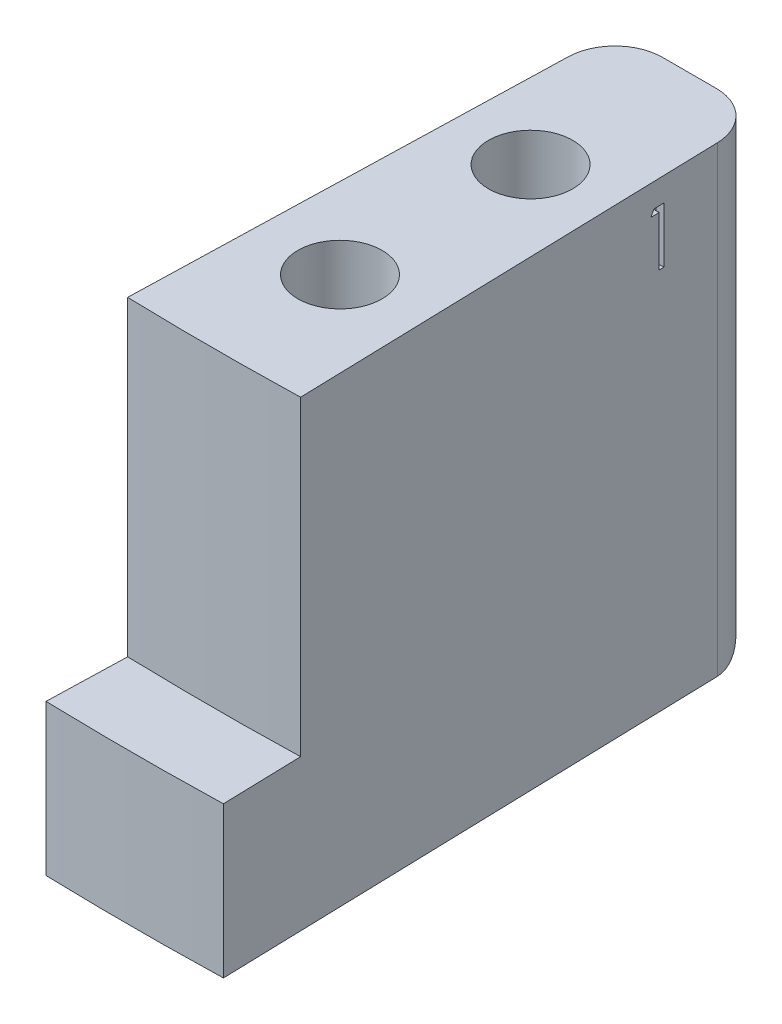
from build123d import *

# Parameters (mm, degrees)
EXTRUDE_590_DEPTH   = 29.1
EXTRUDE_638_DEPTH   = 9.5
FILLET_1_R          = 3
HOLE_WIZARD_M5_1_D  = 5.3
CUT_EXTRUDE_1_DEPTH = 5
CUT_EXTRUDE_2_DEPTH = 0.5


with BuildPart() as part:
    # 草图1 → Extrude 590 (new body)
    with BuildSketch(Plane(origin=(0, 0, 0), x_dir=(1, 0, 0), z_dir=(0, 1, 0))):
        with BuildLine():
            Line((4.608867317, -165), (-4.608867317, -165))
            Line((-4.608867317, -165), (-5.444719551, -194.923972433))
            ThreePointArc((-5.444719551, -194.923972433), (0, -195), (5.444719551, -194.923972433))
            Line((5.444719551, -194.923972433), (4.608867317, -165))
        make_face()
    extrude(amount=EXTRUDE_590_DEPTH)

    # 草图1<3> → Extrude 638 (add)
    with BuildSketch(Plane(origin=(0, 0, 0), x_dir=(1, 0, 0), z_dir=(0, 1, 0))):
        with BuildLine():
            ThreePointArc((5.444719551, -194.923972433), (0, -195), (-5.444719551, -194.923972433))
            Line((-5.444719551, -194.923972433), (-5.584327745, -199.922023008))
            ThreePointArc((-5.584327745, -199.922023008), (0, -200), (5.584327745, -199.922023008))
            Line((5.584327745, -199.922023008), (5.444719551, -194.923972433))
        make_face()
    extrude(amount=EXTRUDE_638_DEPTH)

    # 圆角1
    fillet_1_edges = [part.edges().sort_by_distance(p)[0] for p in [
        (4.608867317, 14.55, 165),
        (0, 0, 165),
        (-4.608867317, 14.55, 165),
    ]]
    fillet(fillet_1_edges, radius=FILLET_1_R)

    # M5 间隙孔1 (through all)
    with Locations(Plane(origin=(0, 29.1, 0), x_dir=(1, 0, 0), z_dir=(0, 1, 0))):
        with Locations((0, -187), (0, -175)):
            Hole(HOLE_WIZARD_M5_1_D / 2)

    # 草图6 → 切除-拉伸1 (cut)
    with BuildSketch(Plane.XZ):
        Polygon((0, 179.618802154), (-4, 177.309401077), (-4, 172.690598923), (0, 170.381197846), (4, 172.690598923), (4, 177.309401077), align=None)
        Polygon((0, 191.618802154), (-4, 189.309401077), (-4, 184.690598923), (0, 182.381197846), (4, 184.690598923), (4, 189.309401077), align=None)
    extrude(amount=-CUT_EXTRUDE_1_DEPTH, mode=Mode.SUBTRACT)

    # 草图7 → 切除-拉伸2 (cut)
    with BuildSketch(Plane(origin=(0, 0, 0), x_dir=(-0.027921638723569116, 0, -0.9996101150403545), z_dir=(0.9996101150403545, 0, -0.027921638723569116))):
        Polygon((-172.103223024, 27.6), (-171.456087608, 27.6), (-171.456087608, 24.1), (-171.770190172, 24.1), (-171.770190172, 27.241025641), (-172.30865171, 27.241025641), align=None)
    extrude(amount=-CUT_EXTRUDE_2_DEPTH, mode=Mode.SUBTRACT)


solid = part.part
